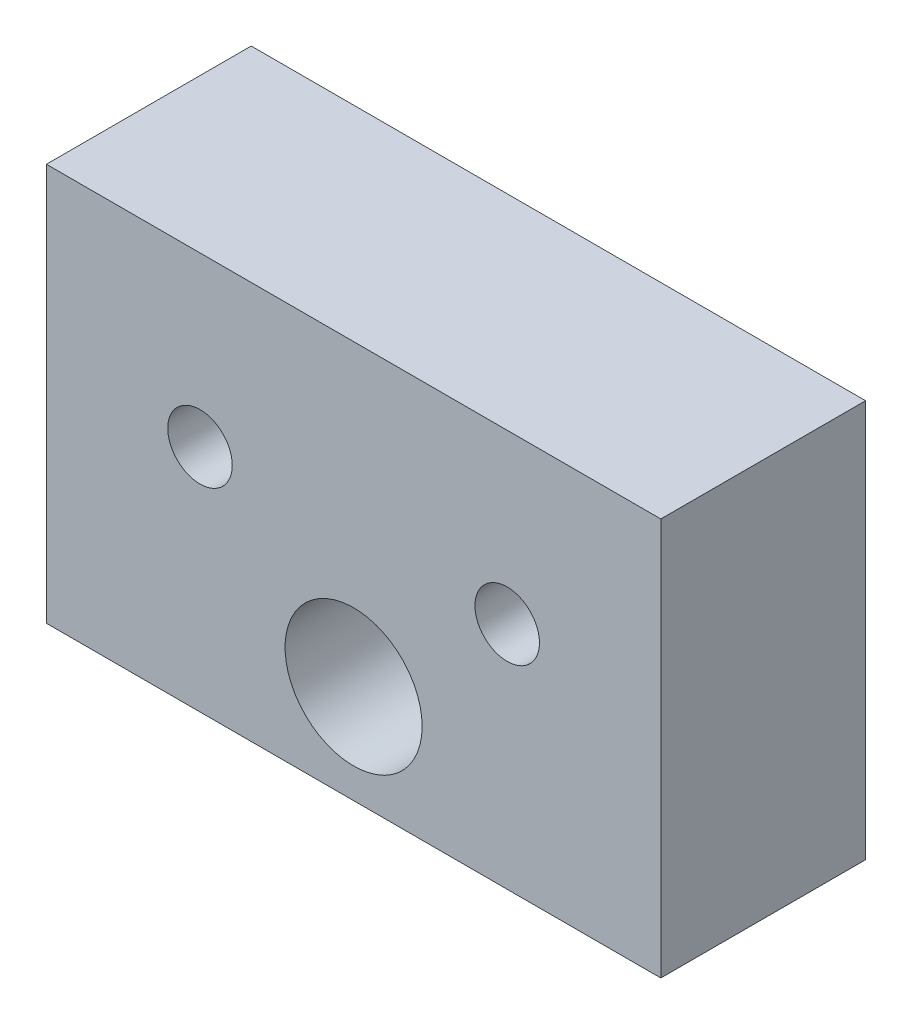
from build123d import *

# Parameters (mm, degrees)
SKETCH1_R           = 4
SKETCH1_R_2         = 8.5
BOSS_EXTRUDE1_DEPTH = 12.7


with BuildPart() as part:
    # Sketch1 → Boss-Extrude1 (new, symmetric)
    with BuildSketch(Plane.XY):
        Polygon((-38.1, 37.084), (38.1, 37.084), (38.1, 12.224), (38.1, -12.224), (-38.1, -12.224), (-38.1, 12.224), align=None)
        with Locations((-19.05, 16.256)):
            Circle(SKETCH1_R, mode=Mode.SUBTRACT)
        with Locations((19.05, 16.256)):
            Circle(SKETCH1_R, mode=Mode.SUBTRACT)
        Circle(SKETCH1_R_2, mode=Mode.SUBTRACT)
    extrude(amount=BOSS_EXTRUDE1_DEPTH, both=True)


solid = part.part
